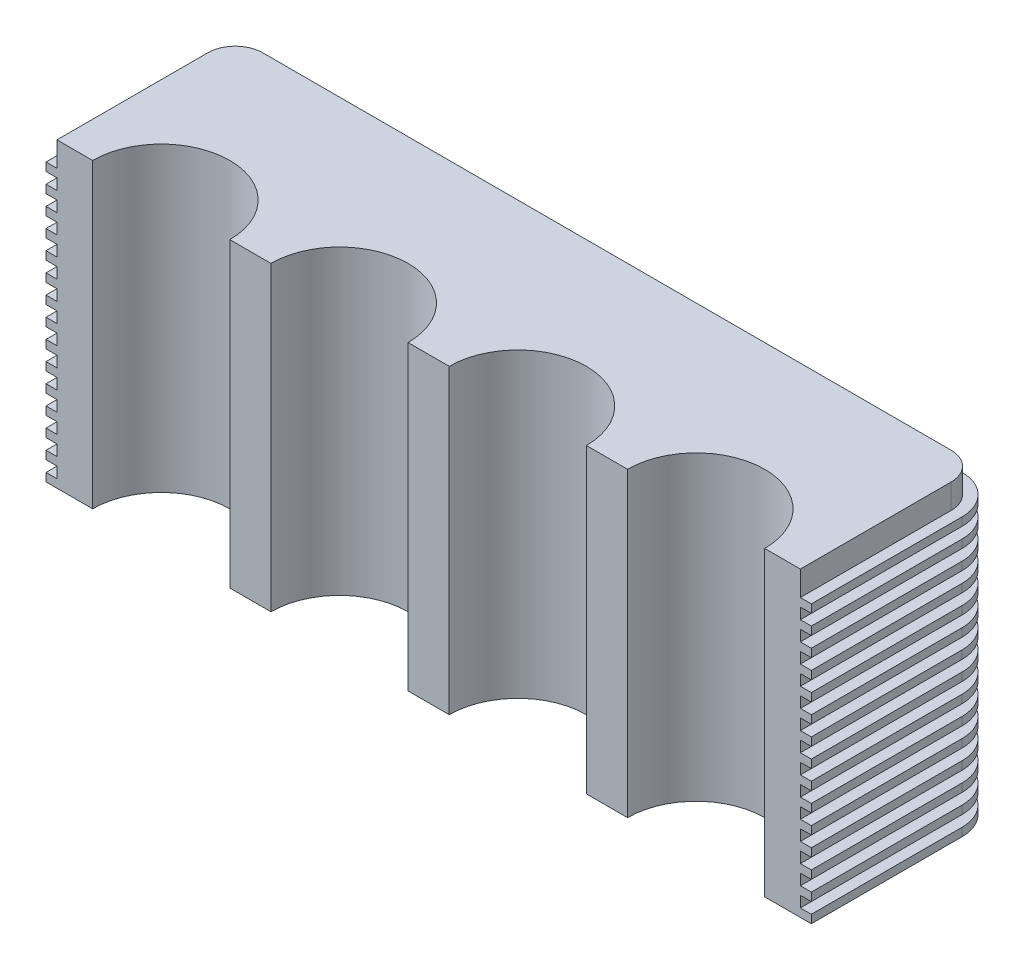
from build123d import *

# Parameters (mm, degrees)
BOSS_EXTRUDE1_DEPTH = 110
BOSS_EXTRUDE2_DEPTH = 3
LPATTERN1_COUNT     = 15
LPATTERN1_PITCH     = 7


with BuildPart() as part:
    # Sketch4 → Boss-Extrude1 (new body)
    with BuildSketch(Plane(origin=(0, 0, 0), x_dir=(1, 0, 0), z_dir=(0, 1, 0))):
        with BuildLine():
            Line((258, 0), (271, 0))
            Line((271, 0), (271, 55))
            ThreePointArc((271, 55), (268.071067812, 62.071067812), (261, 65))
            Line((261, 65), (10, 65))
            ThreePointArc((10, 65), (2.928932188, 62.071067812), (0, 55))
            Line((0, 55), (0, 0))
            Line((0, 0), (13, 0))
            ThreePointArc((13, 0), (38, 25), (63, 0))
            Line((63, 0), (78, 0))
            ThreePointArc((78, 0), (103, 25), (128, 0))
            Line((128, 0), (143, 0))
            ThreePointArc((143, 0), (168, 25), (193, 0))
            Line((193, 0), (208, 0))
            ThreePointArc((208, 0), (233, 25), (258, 0))
        make_face()
    extrude(amount=BOSS_EXTRUDE1_DEPTH)

    # Sketch5 → Boss-Extrude2 (add)
    with BuildSketch(Plane(origin=(0, 0, 0), x_dir=(1, 0, 0), z_dir=(0, 1, 0))):
        with BuildLine():
            Line((275, 0), (275, 55))
            ThreePointArc((275, 55), (270.899494937, 64.899494937), (261, 69))
            Line((261, 69), (10, 69))
            ThreePointArc((10, 69), (0.100505063, 64.899494937), (-4, 55))
            Line((-4, 55), (-4, 0))
            Line((-4, 0), (0, 0))
            Line((0, 0), (0, 55))
            ThreePointArc((0, 55), (2.928932188, 62.071067812), (10, 65))
            Line((10, 65), (261, 65))
            ThreePointArc((261, 65), (268.071067812, 62.071067812), (271, 55))
            Line((271, 55), (271, 0))
            Line((271, 0), (275, 0))
        make_face()
    boss_extrude2 = extrude(amount=BOSS_EXTRUDE2_DEPTH)

    # LPattern1: Boss-Extrude2 ×15
    with Locations(*[(0, i * LPATTERN1_PITCH, 0) for i in range(1, LPATTERN1_COUNT)]):
        add(boss_extrude2)


solid = part.part
